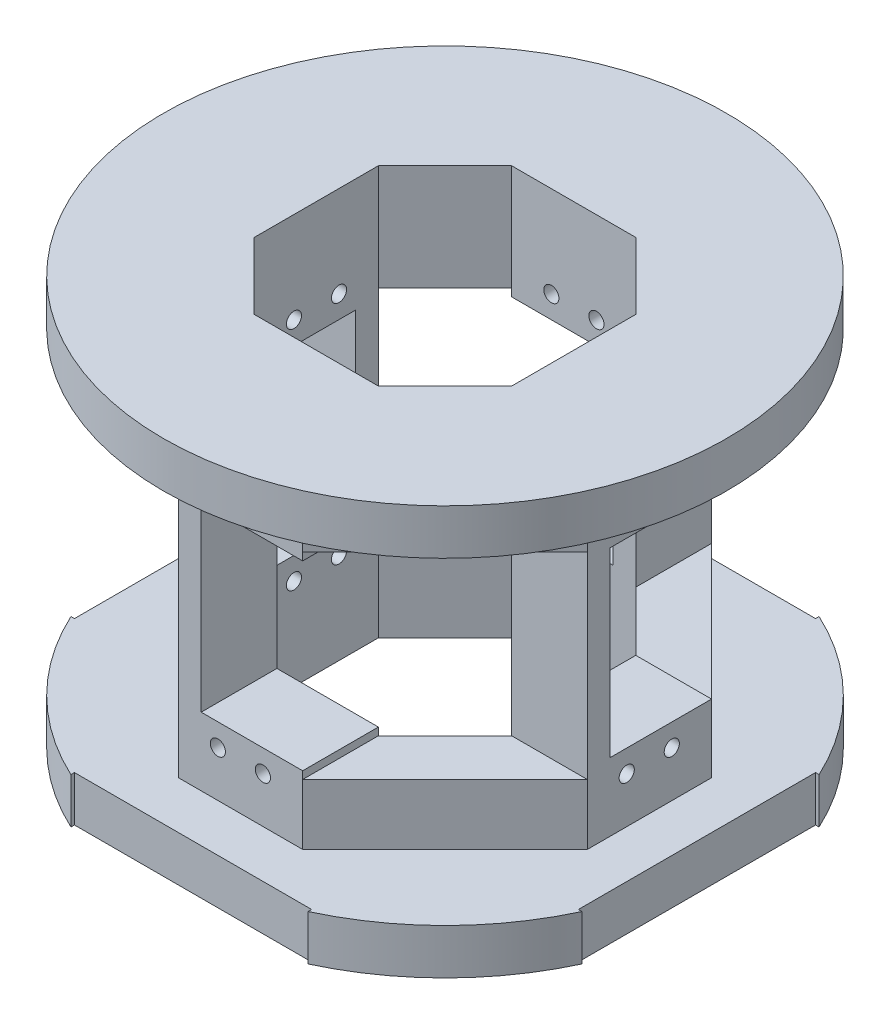
from build123d import *

# Parameters (mm, degrees)
BOSS_EXTRUDE1_DEPTH      = 8.2
BOSS_EXTRUDE1_DEPTH_BACK = 8.2
SKETCH2_W                = 10
SKETCH2_H                = 42
CUT_EXTRUDE1_DEPTH       = 25.662522174
CUT_EXTRUDE1_DEPTH_BACK  = 25.662522174
SKETCH4_R                = 1
SKETCH4_W                = 13.4
SKETCH4_H                = 24
CIRPATTERN1_COUNT        = 4
BOSS_EXTRUDE2_DEPTH      = 8
BOSS_EXTRUDE3_DEPTH      = 8
BOSS_EXTRUDE4_DEPTH      = 6
BOSS_EXTRUDE5_START      = 6
SKETCH23_R               = 37.2
BOSS_EXTRUDE5_DEPTH      = 6


with BuildPart() as part:
    # Sketch2 → Boss-Extrude1 (new, two sides: drawn at the far end of the back side and taken through both)
    with BuildSketch(Plane(origin=(0, 0, 0), x_dir=(0, 0, -1), z_dir=(1, 0, 0)).offset(-BOSS_EXTRUDE1_DEPTH_BACK)):
        with Locations((-22, 0)):
            Rectangle(SKETCH2_W, SKETCH2_H)
    extrude(amount=BOSS_EXTRUDE1_DEPTH + BOSS_EXTRUDE1_DEPTH_BACK)

    # Sketch4 → Cut-Extrude1 (cut, two sides: drawn at the far end of the back side and taken through both)
    with BuildSketch(Plane.XY.offset(27).offset(-CUT_EXTRUDE1_DEPTH_BACK)):
        with Locations((-3, 14.95)):
            Circle(SKETCH4_R)
        with Locations((2.95, 14.95)):
            Circle(SKETCH4_R)
        with Locations((-3, -14.95)):
            Circle(SKETCH4_R)
        with Locations((2.95, -14.95)):
            Circle(SKETCH4_R)
        with Locations((1.5, 0)):
            Rectangle(SKETCH4_W, SKETCH4_H)
    extrude(amount=CUT_EXTRUDE1_DEPTH + CUT_EXTRUDE1_DEPTH_BACK, mode=Mode.SUBTRACT)


with BuildPart() as cirpattern1_1:
    # CirPattern1: pattern copy
    add(part.part.rotate(Axis((0, 12.69022869, 0), (0, -1, 0)), 1 * 360 / CIRPATTERN1_COUNT))


with BuildPart() as cirpattern1_2:
    # CirPattern1: pattern copy
    add(part.part.rotate(Axis((0, 12.69022869, 0), (0, -1, 0)), 2 * 360 / CIRPATTERN1_COUNT))


with BuildPart() as cirpattern1_3:
    # CirPattern1: pattern copy
    add(part.part.rotate(Axis((0, 12.69022869, 0), (0, -1, 0)), 3 * 360 / CIRPATTERN1_COUNT))


with BuildPart() as part_1:
    add(part.part)

    add(cirpattern1_1.part)  # Boss-Extrude2 merges CirPattern1_1

    add(cirpattern1_2.part)  # Boss-Extrude2 merges CirPattern1_2

    add(cirpattern1_3.part)  # Boss-Extrude2 merges CirPattern1_3
    # Sketch20 → Boss-Extrude2 (add)
    with BuildSketch(Plane(origin=(0, 21, 0), x_dir=(1, 0, 0), z_dir=(0, 1, 0))):
        Polygon((-17, 8.2), (-8.2, 17), (-8.2, 27), (-27, 8.2), align=None)
        Polygon((-17, -8.2), (-8.2, -17), (-8.2, -27), (-27, -8.2), align=None)
        Polygon((8.2, -17), (17, -8.2), (27, -8.2), (8.2, -27), align=None)
        Polygon((8.2, 17), (17, 8.2), (27, 8.2), (8.2, 27), align=None)
    extrude(amount=-BOSS_EXTRUDE2_DEPTH)

    # Sketch21 → Boss-Extrude3 (add)
    with BuildSketch(Plane.XZ.offset(21)):
        Polygon((-17, 8.2), (-8.2, 17), (-8.2, 27), (-27, 8.2), align=None)
        Polygon((17, -8.2), (8.2, -17), (8.2, -27), (27, -8.2), align=None)
        Polygon((-8.2, -17), (-17, -8.2), (-27, -8.2), (-8.2, -27), align=None)
        Polygon((8.2, 17), (17, 8.2), (27, 8.2), (8.2, 27), align=None)
    extrude(amount=-BOSS_EXTRUDE3_DEPTH)

    # Sketch22 → Boss-Extrude4 (add)
    with BuildSketch(Plane.XZ.offset(21)):
        with BuildLine():
            ThreePointArc((-15.663157895, 33.741746913), (-26.30437226, 26.30437226), (-33.741746913, 15.663157895))
            Line((-33.741746913, 15.663157895), (-33.274371034, 15.663157895))
            Line((-33.274371034, 15.663157895), (-33.274371034, -15.663157895))
            Line((-33.274371034, -15.663157895), (-33.741746913, -15.663157895))
            ThreePointArc((-33.741746913, -15.663157895), (-26.30437226, -26.30437226), (-15.663157895, -33.741746913))
            Line((-15.663157895, -33.741746913), (-15.663157895, -33.274371034))
            Line((-15.663157895, -33.274371034), (15.663157895, -33.274371034))
            Line((15.663157895, -33.274371034), (15.663157895, -33.741746913))
            ThreePointArc((15.663157895, -33.741746913), (26.30437226, -26.30437226), (33.741746913, -15.663157895))
            Line((33.741746913, -15.663157895), (33.274371034, -15.663157895))
            Line((33.274371034, -15.663157895), (33.274371034, 15.663157895))
            Line((33.274371034, 15.663157895), (33.741746913, 15.663157895))
            ThreePointArc((33.741746913, 15.663157895), (26.30437226, 26.30437226), (15.663157895, 33.741746913))
            Line((15.663157895, 33.741746913), (15.663157895, 33.274371034))
            Line((15.663157895, 33.274371034), (-15.663157895, 33.274371034))
            Line((-15.663157895, 33.274371034), (-15.663157895, 33.741746913))
        make_face()
        Polygon((-17, -8.2), (-17, 8.2), (-8.2, 17), (8.2, 17), (17, 8.2), (17, -8.2), (8.2, -17), (-8.2, -17), align=None, mode=Mode.SUBTRACT)
    extrude(amount=BOSS_EXTRUDE4_DEPTH)

    # Sketch23 → Boss-Extrude5 (add)
    with BuildSketch(Plane(origin=(0, 21, 0), x_dir=(1, 0, 0), z_dir=(0, 1, 0)).offset(BOSS_EXTRUDE5_START)):
        Circle(SKETCH23_R)
        Polygon((-17, 8.2), (-8.2, 17), (8.2, 17), (17, 8.2), (17, -8.2), (8.2, -17), (-8.2, -17), (-17, -8.2), align=None, mode=Mode.SUBTRACT)
    extrude(amount=-BOSS_EXTRUDE5_DEPTH)


solid = part_1.part
